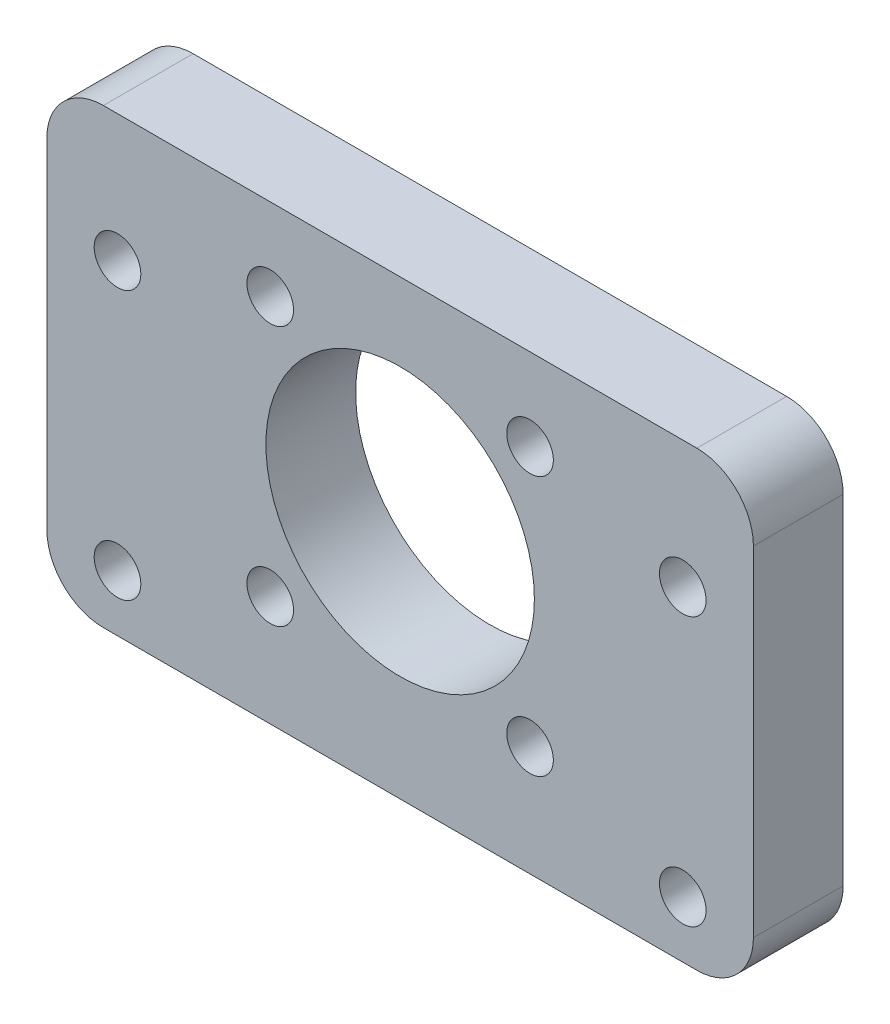
from build123d import *

# Parameters (mm, degrees)
SKETCH1_W           = 50
SKETCH1_H           = 32
SKETCH1_R           = 9.5
SKETCH1_R_2         = 1.65
BOSS_EXTRUDE1_DEPTH = 6.35
SKETCH2_R           = 1.65
CUT_EXTRUDE1_DEPTH  = 31.892110643
FILLET1_R           = 4


with BuildPart() as part:
    # Sketch1 → Boss-Extrude1 (new body)
    with BuildSketch(Plane.XY):
        with Locations((0, -1)):
            Rectangle(SKETCH1_W, SKETCH1_H)
        Circle(SKETCH1_R, mode=Mode.SUBTRACT)
        with Locations((-9.192388155, 9.192388155)):
            Circle(SKETCH1_R_2, mode=Mode.SUBTRACT)
        with Locations((9.192388155, 9.192388155)):
            Circle(SKETCH1_R_2, mode=Mode.SUBTRACT)
        with Locations((9.192388155, -9.192388155)):
            Circle(SKETCH1_R_2, mode=Mode.SUBTRACT)
        with Locations((-9.192388155, -9.192388155)):
            Circle(SKETCH1_R_2, mode=Mode.SUBTRACT)
    extrude(amount=BOSS_EXTRUDE1_DEPTH)

    # Sketch2 → Cut-Extrude1 (cut, through all)
    with BuildSketch(Plane.XY.offset(6.35)):
        with Locations((-20, 6)):
            Circle(SKETCH2_R)
        with Locations((-20, -13)):
            Circle(SKETCH2_R)
        with Locations((20, -13)):
            Circle(SKETCH2_R)
        with Locations((20, 6)):
            Circle(SKETCH2_R)
    extrude(amount=-CUT_EXTRUDE1_DEPTH, mode=Mode.SUBTRACT)

    # Fillet1
    fillet1_edges = [part.edges().sort_by_distance(p)[0] for p in [
        (-25, 15, 3.175),
        (25, 15, 3.175),
        (25, -17, 3.175),
        (-25, -17, 3.175),
    ]]
    fillet(fillet1_edges, radius=FILLET1_R)


solid = part.part
